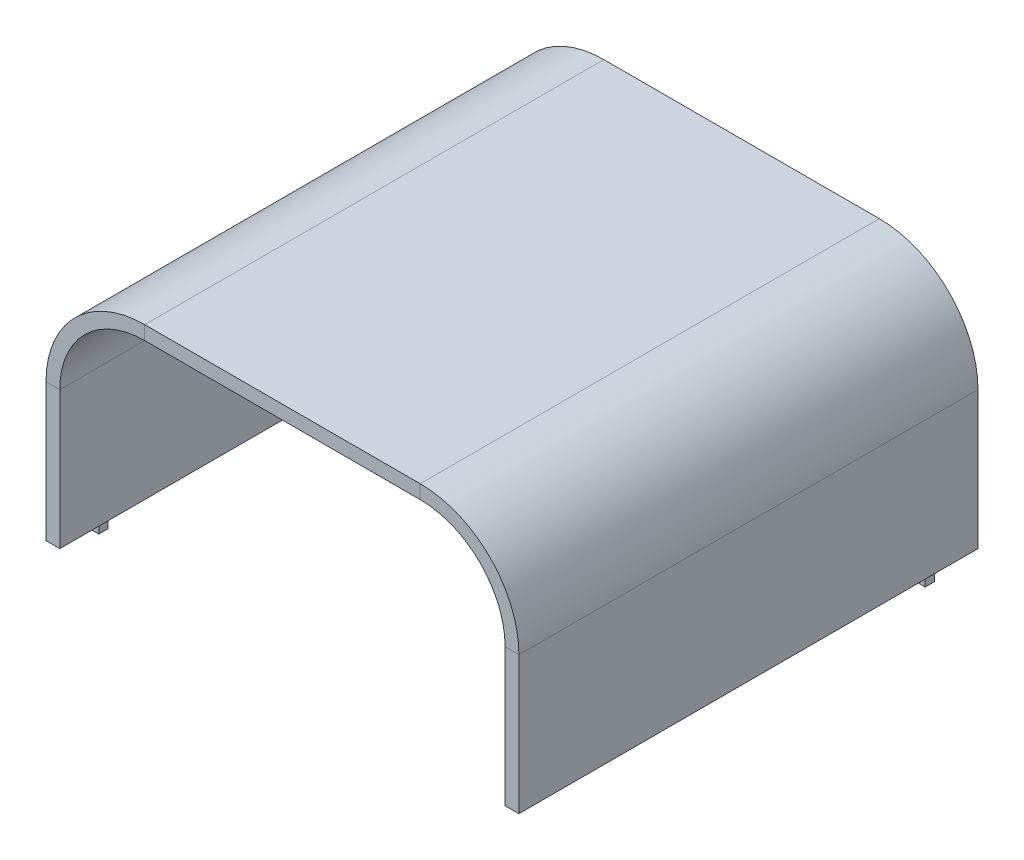
from build123d import *

# Parameters (mm, degrees)
SKETCH2_W           = 15
SKETCH2_H           = 500
SKETCH3_W           = 10
SKETCH3_H           = 10
BOSS_EXTRUDE1_DEPTH = 10
SKETCH3_3_W         = 10
SKETCH3_3_H         = 10
CUT_EXTRUDE1_DEPTH  = 10


with BuildPart() as part:
    # Sweep1: sweep along a path in Sketch1
    with BuildLine(Plane.XY) as sweep1_path:
        Line((-250, 0), (-250, 150))
        ThreePointArc((-250, 150), (-220.710678119, 220.710678119), (-150, 250))
        Line((-150, 250), (150, 250))
        ThreePointArc((150, 250), (220.710678119, 220.710678119), (250, 150))
        Line((250, 150), (250, 0))
    # Sketch2 → Sweep1 (sweep)
    with BuildSketch(Plane(origin=(0, 0, 0), x_dir=(1, 0, 0), z_dir=(0, 1, 0))):
        with Locations((-250, 0)):
            Rectangle(SKETCH2_W, SKETCH2_H)
    sweep(path=sweep1_path.line)

    # Sketch3 → Boss-Extrude1 (add)
    with BuildSketch(Plane.XZ):
        with Locations((-250, 200)):
            Rectangle(SKETCH3_W, SKETCH3_H)
        with Locations((250, -200)):
            Rectangle(SKETCH3_W, SKETCH3_H)
    extrude(amount=BOSS_EXTRUDE1_DEPTH)

    # Sketch3<3> → Cut-Extrude1 (cut)
    with BuildSketch(Plane.XZ):
        with Locations((250, 200)):
            Rectangle(SKETCH3_3_W, SKETCH3_3_H)
        with Locations((-250, -200)):
            Rectangle(SKETCH3_3_W, SKETCH3_3_H)
    extrude(amount=-CUT_EXTRUDE1_DEPTH, mode=Mode.SUBTRACT)


solid = part.part
